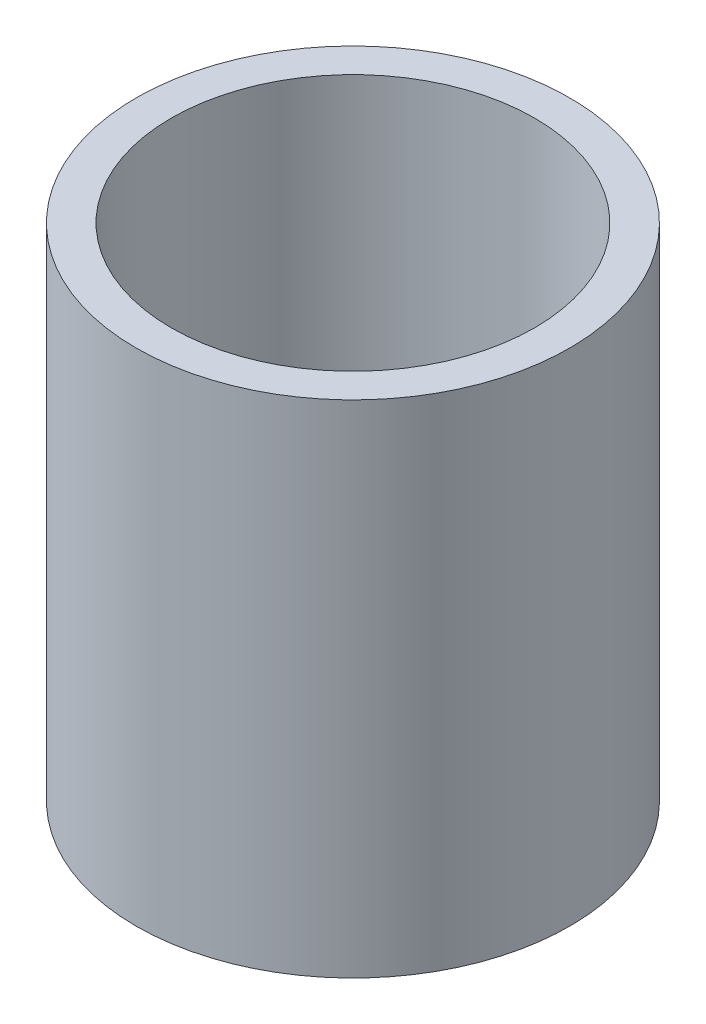
from build123d import *

# Parameters (mm, degrees)
SKETCH1_R           = 30.3
SKETCH1_R_2         = 25.4
BOSS_EXTRUDE1_DEPTH = 70


with BuildPart() as part:
    # Sketch1 → Boss-Extrude1 (new body)
    with BuildSketch(Plane(origin=(0, 0, 0), x_dir=(1, 0, 0), z_dir=(0, 1, 0))):
        with Locations(Location((0, 0, 0), (0, 0, 270))):
            Circle(SKETCH1_R)
        with Locations(Location((0, 0, 0), (0, 0, 270))):
            Circle(SKETCH1_R_2, mode=Mode.SUBTRACT)
    extrude(amount=BOSS_EXTRUDE1_DEPTH)


solid = part.part
